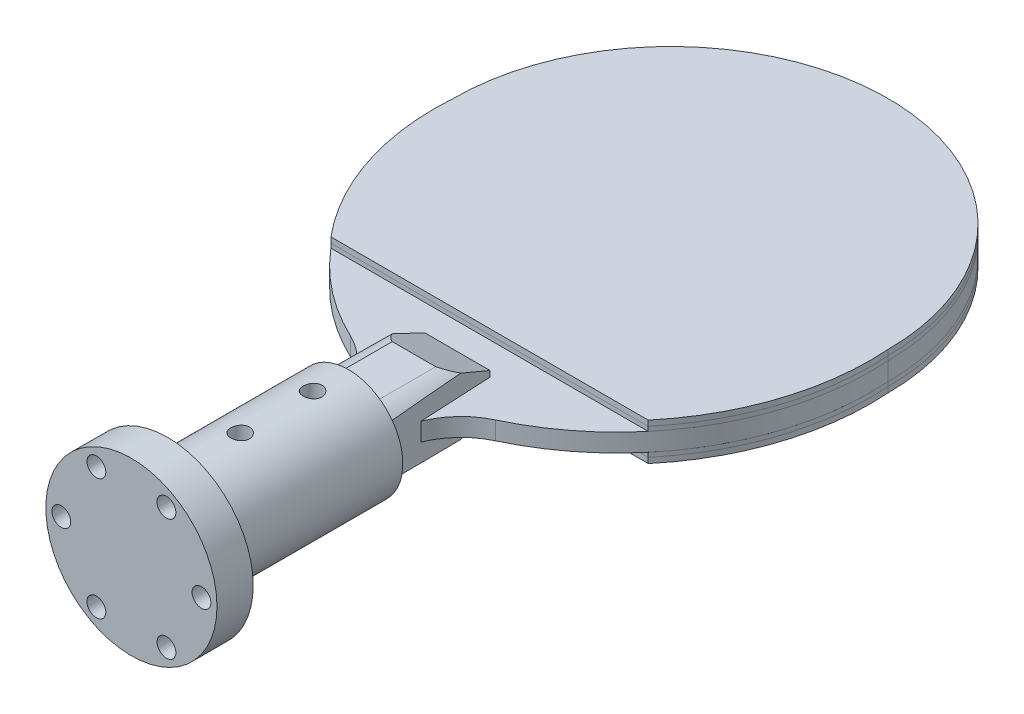
from build123d import *

# Parameters (mm, degrees)
BOSS_EXTRUDE1_DEPTH      = 6.35
BOSS_EXTRUDE2_DEPTH      = 1.524
BOSS_EXTRUDE4_DEPTH      = 1.905
BOSS_EXTRUDE5_DEPTH      = 1.524
BOSS_EXTRUDE6_DEPTH      = 1.905
BOSS_EXTRUDE7_DEPTH      = 8.89
CUT_EXTRUDE1_DEPTH       = 101.6
CUT_EXTRUDE2_DEPTH       = 25.4
BOSS_EXTRUDE8_DEPTH      = 12.7
BOSS_EXTRUDE8_DEPTH_BACK = 63.5
SKETCH10_R               = 30
CUT_EXTRUDE3_DEPTH       = 207.614341078
CUT_EXTRUDE3_DEPTH_BACK  = 207.614341078
SKETCH11_R               = 3.302
SKETCH12_R               = 37.410061843
SKETCH12_R_2             = 19.05
CUT_EXTRUDE4_DEPTH       = 63.5
SKETCH13_R               = 3.302
CUT_EXTRUDE6_DEPTH       = 266.958156432
CIRPATTERN1_COUNT        = 6


with BuildPart() as part:
    # Sketch2 → Boss-Extrude1 (new body)
    with BuildSketch(Plane(origin=(0, 0, 0), x_dir=(1, 0, 0), z_dir=(0, 1, 0))):
        with BuildLine():
            Line((-12.7, -100.170905775), (-16.376657923, -173.704064228))
            ThreePointArc((-16.376657923, -173.704064228), (-15.680177156, -175.581537443), (-13.839826982, -176.370905775))
            Line((-13.839826982, -176.370905775), (13.839826982, -176.370905775))
            ThreePointArc((13.839826982, -176.370905775), (15.680177156, -175.581537443), (16.376657923, -173.704064228))
            Line((16.376657923, -173.704064228), (12.7, -100.170905775))
            ThreePointArc((12.7, -100.170905775), (17.790636658, -92.280726172), (25.4, -86.779171366))
            ThreePointArc((25.4, -86.779171366), (64.24812298, -51.26203522), (76.2, 0))
            ThreePointArc((76.2, 0), (0, 76.2), (-76.2, 0))
            ThreePointArc((-76.2, 0), (-64.24812298, -51.26203522), (-25.4, -86.779171366))
            ThreePointArc((-25.4, -86.779171366), (-17.790636658, -92.280726172), (-12.7, -100.170905775))
        make_face()
    extrude(amount=BOSS_EXTRUDE1_DEPTH)

    # Sketch7 → Boss-Extrude7 (add)
    with BuildSketch(Plane(origin=(0, 6.35, 0), x_dir=(1, 0, 0), z_dir=(0, 1, 0))):
        with BuildLine():
            Line((-11.43, -74.770905775), (-16.376657923, -173.704064228))
            ThreePointArc((-16.376657923, -173.704064228), (-15.680177156, -175.581537443), (-13.839826982, -176.370905775))
            Line((-13.839826982, -176.370905775), (13.839826982, -176.370905775))
            ThreePointArc((13.839826982, -176.370905775), (15.680177156, -175.581537443), (16.376657923, -173.704064228))
            Line((16.376657923, -173.704064228), (11.43, -74.770905775))
            Line((11.43, -74.770905775), (-11.43, -74.770905775))
        make_face()
    boss_extrude7 = extrude(amount=BOSS_EXTRUDE7_DEPTH)

    # Sketch8 → Cut-Extrude1 (cut)
    with BuildSketch(Plane.XY.offset(176.370905775)):
        with BuildLine():
            Line((-13.839826982, 15.24), (-7.62, 15.24))
            ThreePointArc((-7.62, 15.24), (-12.921650252, 12.489613458), (-16.379826982, 7.62))
            Line((-16.379826982, 7.62), (-16.379826982, 15.24))
            Line((-16.379826982, 15.24), (-13.839826982, 15.24))
        make_face()
        with BuildLine():
            Line((16.379826982, 15.24), (13.839826982, 15.24))
            Line((13.839826982, 15.24), (7.62, 15.24))
            ThreePointArc((7.62, 15.24), (12.921650252, 12.489613458), (16.379826982, 7.62))
            Line((16.379826982, 7.62), (16.379826982, 15.24))
        make_face()
    cut_extrude1 = extrude(amount=-CUT_EXTRUDE1_DEPTH, mode=Mode.SUBTRACT)

    # Sketch9 → Cut-Extrude2 (cut, symmetric)
    with BuildSketch(Plane(origin=(0, 0, -0.19192658), x_dir=(0, 0, -1), z_dir=(1, 0, 0))):
        Polygon((-74.962832355, 8.382), (-90.202832355, 15.24), (-74.962832355, 15.24), align=None)
    cut_extrude2 = extrude(amount=CUT_EXTRUDE2_DEPTH, both=True, mode=Mode.SUBTRACT)

    # Mirror8: Boss-Extrude7, Cut-Extrude1, Cut-Extrude2 across plane
    add(boss_extrude7.mirror(Plane.ZX.offset(3.175)))
    add(cut_extrude1.mirror(Plane.ZX.offset(3.175)), mode=Mode.SUBTRACT)
    add(cut_extrude2.mirror(Plane.ZX.offset(3.175)), mode=Mode.SUBTRACT)

    # Sketch10 → Boss-Extrude8 (add, two sides: drawn at the far end of the back side and taken through both)
    with BuildSketch(Plane.XY.offset(176.370905775).offset(-BOSS_EXTRUDE8_DEPTH_BACK)):
        with Locations((0, 3.175)):
            Circle(SKETCH10_R)
    extrude(amount=BOSS_EXTRUDE8_DEPTH + BOSS_EXTRUDE8_DEPTH_BACK)

    # Sketch11 → Cut-Extrude3 (cut, two sides: drawn at the far end of the back side and taken through both)
    with BuildSketch(Plane(origin=(0, 0, 0), x_dir=(1, 0, 0), z_dir=(0, 1, 0)).offset(-CUT_EXTRUDE3_DEPTH_BACK)):
        with Locations((0, -125.570905775)):
            Circle(SKETCH11_R)
        with Locations((0, -150.970905775)):
            Circle(SKETCH11_R)
    extrude(amount=CUT_EXTRUDE3_DEPTH + CUT_EXTRUDE3_DEPTH_BACK, mode=Mode.SUBTRACT)

    # Sketch12 → Cut-Extrude4 (cut)
    with BuildSketch(Plane(origin=(0, 0, 112.870905775), x_dir=(-1, 0, 0), z_dir=(0, 0, -1))):
        with Locations((0.090742593, 2.899627676)):
            Circle(SKETCH12_R)
        with Locations((0.090742593, 2.899627676)):
            Circle(SKETCH12_R_2, mode=Mode.SUBTRACT)
    extrude(amount=-CUT_EXTRUDE4_DEPTH, mode=Mode.SUBTRACT)

    # Sketch13 → Cut-Extrude6 (cut, through all)
    with BuildSketch(Plane(origin=(0, 0, 176.370905775), x_dir=(-1, 0, 0), z_dir=(0, 0, -1))):
        with Locations((24.569376101, 3.175)):
            Circle(SKETCH13_R)
    cut_extrude6 = extrude(amount=-CUT_EXTRUDE6_DEPTH, mode=Mode.SUBTRACT)

    # CirPattern1: Cut-Extrude6 ×6 about axis
    cirpattern1_axis = Axis((0, 3.175, 176.370905775), (0, 0, 1))
    for i in range(1, CIRPATTERN1_COUNT):
        add(cut_extrude6.rotate(cirpattern1_axis, i * 360 / CIRPATTERN1_COUNT), mode=Mode.SUBTRACT)


with BuildPart() as body_2:
    # Sketch3 → Boss-Extrude2 (new body)
    with BuildSketch(Plane(origin=(0, 6.35, 0), x_dir=(1, 0, 0), z_dir=(0, 1, 0))):
        with BuildLine():
            Line((-55.623239344, -63.5), (55.623239344, -63.5))
            ThreePointArc((55.623239344, -63.5), (72.09775167, -33.754575709), (76.2, 0))
            ThreePointArc((76.2, 0), (0, 76.2), (-76.2, 0))
            ThreePointArc((-76.2, 0), (-72.09775167, -33.754575709), (-55.623239344, -63.5))
        make_face()
    extrude(amount=BOSS_EXTRUDE2_DEPTH)


with BuildPart() as body_3:
    # Sketch4 → Boss-Extrude4 (new body)
    with BuildSketch(Plane(origin=(0, 7.874, 0), x_dir=(1, 0, 0), z_dir=(0, 1, 0))):
        with BuildLine():
            Line((-55.623239344, -63.5), (55.623239344, -63.5))
            ThreePointArc((55.623239344, -63.5), (72.09775167, -33.754575709), (76.2, 0))
            ThreePointArc((76.2, 0), (0, 76.2), (-76.2, 0))
            ThreePointArc((-76.2, 0), (-72.09775167, -33.754575709), (-55.623239344, -63.5))
        make_face()
    extrude(amount=BOSS_EXTRUDE4_DEPTH)


with BuildPart() as body_4:
    # Sketch5 → Boss-Extrude5 (new body)
    with BuildSketch(Plane.XZ):
        with BuildLine():
            Line((55.623239344, 63.5), (-55.623239344, 63.5))
            ThreePointArc((-55.623239344, 63.5), (-72.09775167, 33.754575709), (-76.2, 0))
            ThreePointArc((-76.2, 0), (0, -76.2), (76.2, 0))
            ThreePointArc((76.2, 0), (72.09775167, 33.754575709), (55.623239344, 63.5))
        make_face()
    extrude(amount=BOSS_EXTRUDE5_DEPTH)


with BuildPart() as body_5:
    # Sketch6 → Boss-Extrude6 (new body)
    with BuildSketch(Plane.XZ.offset(1.524)):
        with BuildLine():
            Line((55.623239344, 63.5), (-55.623239344, 63.5))
            ThreePointArc((-55.623239344, 63.5), (-72.09775167, 33.754575709), (-76.2, 0))
            ThreePointArc((-76.2, 0), (0, -76.2), (76.2, 0))
            ThreePointArc((76.2, 0), (72.09775167, 33.754575709), (55.623239344, 63.5))
        make_face()
    extrude(amount=BOSS_EXTRUDE6_DEPTH)


solid = Compound([part.part, body_2.part, body_3.part, body_4.part, body_5.part])
